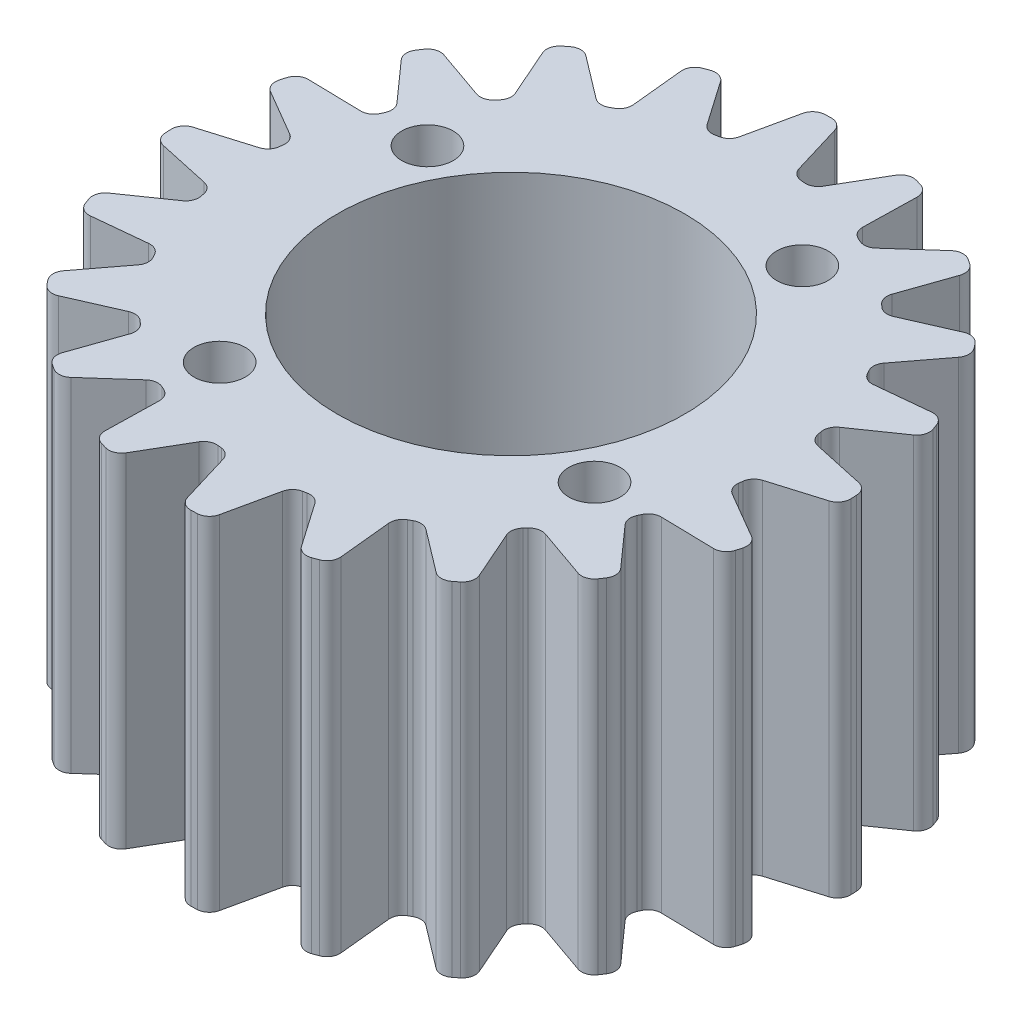
from build123d import *

# Parameters (mm, degrees)
ENL_V_MAT_EXTRU_3_DEPTH            = 136.122166945
CONG_1_R                           = 3
R_P_TITION_CIRCULAIRE1_COUNT       = 20
CONG_1_OF_R_P_TITION_CIRCULAIRE1_R = 3
ESQUISSE6_R                        = 40.5
ESQUISSE6_R_2                      = 6
ENL_V_MAT_EXTRU_4_DEPTH            = 136.084248382


with BuildPart() as part:
    # Esquisse1 → Révolution1 (revolve)
    with BuildSketch(Plane.XY, mode=Mode.PRIVATE) as r_volution1_sk:
        Polygon((-77, 80), (-77, 0), (-70, 0), (0, 0), (0, 80), (-70, 80), align=None)
    revolve(r_volution1_sk.sketch.rotate(Axis((0, 80, 0), (0, -1, 0)), 270), axis=Axis((0, 80, 0), (0, -1, 0)))

    # Esquisse5 → Enlèv. mat.-Extru.3 (cut, through all)
    with BuildSketch(Plane(origin=(0, 80, 0), x_dir=(1, 0, 0), z_dir=(0, 1, 0))):
        with BuildLine():
            ThreePointArc((-6.041350371, 76.762634697), (-15.021954795, 75.520466591), (-23.794308567, 73.231351755))
            Line((-23.794308567, 73.231351755), (-14.298528536, 59.557657624))
            Line((-14.298528536, 59.557657624), (-9.581610984, 60.495910861))
            Line((-9.581610984, 60.495910861), (-6.041350371, 76.762634697))
        make_face()
    enl_v_mat_extru_3 = extrude(amount=-ENL_V_MAT_EXTRU_3_DEPTH, mode=Mode.SUBTRACT)

    # Congé1
    cong_1_edges = [part.edges().sort_by_distance(p)[0] for p in [
        (-9.581610984, 40, -60.495910861),
        (-14.298528536, 40, -59.557657624),
        (-23.794308567, 40, -73.231351755),
        (-6.041350371, 40, -76.762634697),
    ]]
    fillet(cong_1_edges, radius=CONG_1_R)

    # Répétition circulaire1: Enlèv. mat.-Extru.3 ×20 about axis
    r_p_tition_circulaire1_axis = Axis((0, 0, 0), (0, 1, 0))
    for i in range(1, R_P_TITION_CIRCULAIRE1_COUNT):
        add(enl_v_mat_extru_3.rotate(r_p_tition_circulaire1_axis, i * 360 / R_P_TITION_CIRCULAIRE1_COUNT), mode=Mode.SUBTRACT)

    # Congé1 of Répétition circulaire1
    cong_1_of_r_p_tition_circulaire1_edges = [part.edges().sort_by_distance(p)[0] for p in [
        (-27.806918109, 40, -54.574149607),
        (-32.003037089, 40, -52.224210067),
        (-45.259464427, 40, -62.294308567),
        (-29.466624292, 40, -71.138724003),
        (-43.310290348, 40, -43.310290348),
        (-46.574865393, 40, -39.77869296),
        (-62.294308567, 40, -45.259464427),
        (-50.007499721, 40, -58.551259351),
        (-54.574149607, 40, -27.806918109),
        (-56.587621366, 40, -23.439360232),
        (-73.231351755, 40, -23.794308567),
        (-65.653292655, 40, -40.232389483),
        (-60.495910861, 40, -9.581610984),
        (-61.061186691, 40, -4.805619613),
        (-77, 40, 0),
        (-74.872483871, 40, -17.975293017),
        (-60.495910861, 40, 9.581610984),
        (-59.557657624, 40, 14.298528536),
        (-73.231351755, 40, 23.794308567),
        (-76.762634697, 40, 6.041350371),
        (-54.574149607, 40, 27.806918109),
        (-52.224210067, 40, 32.003037089),
        (-62.294308567, 40, 45.259464427),
        (-71.138724003, 40, 29.466624292),
        (-43.310290348, 40, 43.310290348),
        (-39.77869296, 40, 46.574865393),
        (-45.259464427, 40, 62.294308567),
        (-58.551259351, 40, 50.007499721),
        (-27.806918109, 40, 54.574149607),
        (-23.439360232, 40, 56.587621366),
        (-23.794308567, 40, 73.231351755),
        (-40.232389483, 40, 65.653292655),
        (-9.581610984, 40, 60.495910861),
        (-4.805619613, 40, 61.061186691),
        (0, 40, 77),
        (-17.975293017, 40, 74.872483871),
        (9.581610984, 40, 60.495910861),
        (14.298528536, 40, 59.557657624),
        (23.794308567, 40, 73.231351755),
        (6.041350371, 40, 76.762634697),
        (27.806918109, 40, 54.574149607),
        (32.003037089, 40, 52.224210067),
        (45.259464427, 40, 62.294308567),
        (29.466624292, 40, 71.138724003),
        (43.310290348, 40, 43.310290348),
        (46.574865393, 40, 39.77869296),
        (62.294308567, 40, 45.259464427),
        (50.007499721, 40, 58.551259351),
        (54.574149607, 40, 27.806918109),
        (56.587621366, 40, 23.439360232),
        (73.231351755, 40, 23.794308567),
        (65.653292655, 40, 40.232389483),
        (60.495910861, 40, 9.581610984),
        (61.061186691, 40, 4.805619613),
        (77, 40, 0),
        (74.872483871, 40, 17.975293017),
        (60.495910861, 40, -9.581610984),
        (59.557657624, 40, -14.298528536),
        (73.231351755, 40, -23.794308567),
        (76.762634697, 40, -6.041350371),
        (54.574149607, 40, -27.806918109),
        (52.224210067, 40, -32.003037089),
        (62.294308567, 40, -45.259464427),
        (71.138724003, 40, -29.466624292),
        (43.310290348, 40, -43.310290348),
        (39.77869296, 40, -46.574865393),
        (45.259464427, 40, -62.294308567),
        (58.551259351, 40, -50.007499721),
        (27.806918109, 40, -54.574149607),
        (23.439360232, 40, -56.587621366),
        (23.794308567, 40, -73.231351755),
        (40.232389483, 40, -65.653292655),
        (9.581610984, 40, -60.495910861),
        (4.805619613, 40, -61.061186691),
        (0, 40, -77),
        (17.975293017, 40, -74.872483871),
    ]]
    fillet(cong_1_of_r_p_tition_circulaire1_edges, radius=CONG_1_OF_R_P_TITION_CIRCULAIRE1_R)

    # Esquisse6 → Enlèv. mat.-Extru.4 (cut, through all)
    with BuildSketch(Plane(origin=(0, 80, 0), x_dir=(1, 0, 0), z_dir=(0, 1, 0))):
        with Locations(Location((0, 0, 0), (0, 0, 270))):
            Circle(ESQUISSE6_R)
        with Locations(Location((-43.72438148, 24.236820423, 0), (0, 0, 270))):
            Circle(ESQUISSE6_R_2)
        with Locations(Location((-24.236820423, -43.72438148, 0), (0, 0, 270))):
            Circle(ESQUISSE6_R_2)
        with Locations((-13.980853572, 90.875110984)):
            Circle(ESQUISSE6_R_2)
        with Locations(Location((24.236820423, 43.72438148, 0), (0, 0, 270))):
            Circle(ESQUISSE6_R_2)
        with Locations(Location((43.72438148, -24.236820423, 0), (0, 0, 270))):
            Circle(ESQUISSE6_R_2)
    extrude(amount=-ENL_V_MAT_EXTRU_4_DEPTH, mode=Mode.SUBTRACT)


solid = part.part
